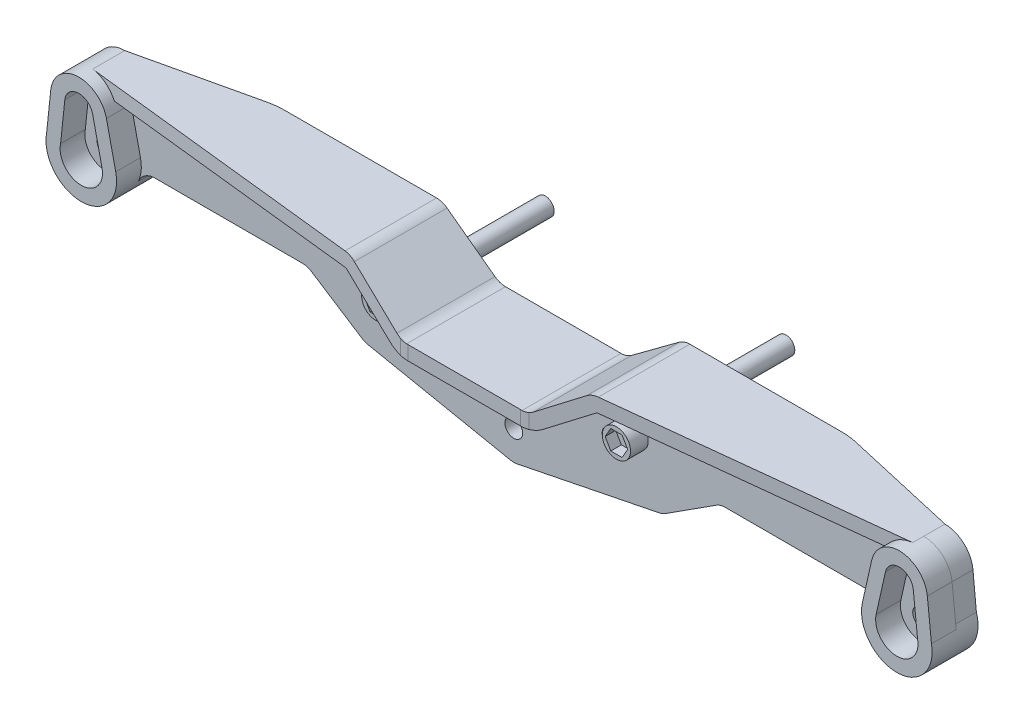
from build123d import *
from build123d.topology import SkipClean

# Parameters (mm, degrees)
SKETCH3_R                = 1.25
BOSS_EXTRUDE2_DEPTH      = 3
BOSS_EXTRUDE3_DEPTH      = 7
BOSS_EXTRUDE3_DEPTH_BACK = 7
CUT_EXTRUDE1_DEPTH       = 67.575853844
BOSS_EXTRUDE4_DEPTH      = 3.5
BOSS_EXTRUDE5_DEPTH      = 4
SKETCH9_R                = 2
BOSS_EXTRUDE6_DEPTH      = 2.5
BOSS_EXTRUDE7_START      = -24
SKETCH10_R               = 1.25
BOSS_EXTRUDE7_DEPTH      = 24
CUT_EXTRUDE2_DEPTH       = 1.5
BOSS_EXTRUDE8_START      = 2.5
SKETCH12_R               = 1.25
BOSS_EXTRUDE8_DEPTH      = 2.5


with BuildPart() as part:
    # Sketch3 → Boss-Extrude2 (new body)
    with BuildSketch(Plane.XY):
        with BuildLine():
            Line((-58.067604658, 9.129873432), (-17.927673113, 9.129873432))
            ThreePointArc((-17.927673113, 9.129873432), (-17.144364104, 9.003989478), (-16.439939924, 8.63901503))
            Line((-16.439939924, 8.63901503), (-9.662890391, 3.620731835))
            ThreePointArc((-9.662890391, 3.620731835), (-8.958466211, 3.255757387), (-8.175157202, 3.129873432))
            Line((-8.175157202, 3.129873432), (8.175157202, 3.129873432))
            ThreePointArc((8.175157202, 3.129873432), (8.958466211, 3.255757387), (9.662890391, 3.620731835))
            Line((9.662890391, 3.620731835), (16.439939924, 8.63901503))
            ThreePointArc((16.439939924, 8.63901503), (17.144364104, 9.003989478), (17.927673113, 9.129873432))
            Line((17.927673113, 9.129873432), (58.024732939, 9.129873432))
            ThreePointArc((58.024732939, 9.129873432), (60.713666824, 8.091230311), (62.006179367, 5.514690714))
            Line((62.006179367, 5.514690714), (62.485680247, 0.553616565))
            ThreePointArc((62.485680247, 0.553616565), (59.4550541, -5.663918261), (53.112535099, -2.904409812))
            ThreePointArc((53.112535099, -2.904409812), (52.191454269, -1.788745789), (50.80658819, -1.370126568))
            Line((50.80658819, -1.370126568), (29.971601132, -1.370126568))
            ThreePointArc((29.971601132, -1.370126568), (29.266449795, -1.471635044), (28.618561527, -1.767917294))
            Line((28.618561527, -1.767917294), (21.476313645, -6.364864122))
            ThreePointArc((21.476313645, -6.364864122), (21.063134423, -6.579260655), (20.617370927, -6.713342154))
            Line((20.617370927, -6.713342154), (0.494096887, -10.770508908))
            ThreePointArc((0.494096887, -10.770508908), (0, -10.819821603), (-0.494096887, -10.770508908))
            Line((-0.494096887, -10.770508908), (-20.617370927, -6.713342154))
            ThreePointArc((-20.617370927, -6.713342154), (-21.063134423, -6.579260655), (-21.476313645, -6.364864122))
            Line((-21.476313645, -6.364864122), (-28.618561527, -1.767917294))
            ThreePointArc((-28.618561527, -1.767917294), (-29.266449795, -1.471635044), (-29.971601132, -1.370126568))
            Line((-29.971601132, -1.370126568), (-50.80658819, -1.370126568))
            ThreePointArc((-50.80658819, -1.370126568), (-52.191454269, -1.788745789), (-53.112535099, -2.904409812))
            ThreePointArc((-53.112535099, -2.904409812), (-58.972993776, -5.814575808), (-62.69520812, -0.433204011))
            Line((-62.69520812, -0.433204011), (-62.044228019, 5.561691263))
            ThreePointArc((-62.044228019, 5.561691263), (-60.739002108, 8.107059295), (-58.067604658, 9.129873432))
        make_face()
        with Locations((0, -6.620126568)):
            Circle(SKETCH3_R, mode=Mode.SUBTRACT)
        with Locations((-57.724428918, -0.9729763)):
            Circle(SKETCH3_R, mode=Mode.SUBTRACT)
        with Locations(Location((57.724428918, -0.9729763, 0), (0, 0, 180))):
            Circle(SKETCH3_R, mode=Mode.SUBTRACT)
        with Locations((-20.303113823, 3.613972241)):
            Circle(SKETCH3_R, mode=Mode.SUBTRACT)
        with Locations((-17.030694447, 1.32049797)):
            Circle(SKETCH3_R, mode=Mode.SUBTRACT)
        with Locations((-13.758275071, -0.9729763)):
            Circle(SKETCH3_R, mode=Mode.SUBTRACT)
        with Locations(Location((13.758275071, -0.9729763, 0), (0, 0, 180))):
            Circle(SKETCH3_R, mode=Mode.SUBTRACT)
        with Locations(Location((17.030694447, 1.32049797, 0), (0, 0, 180))):
            Circle(SKETCH3_R, mode=Mode.SUBTRACT)
        with Locations(Location((20.303113823, 3.613972241, 0), (0, 0, 180))):
            Circle(SKETCH3_R, mode=Mode.SUBTRACT)
    extrude(amount=BOSS_EXTRUDE2_DEPTH)

    # Sketch5 → Boss-Extrude3 (add, two sides: drawn at the far end of the back side and taken through both)
    with BuildSketch(Plane.XY.offset(3).offset(-BOSS_EXTRUDE3_DEPTH_BACK)):
        with BuildLine():
            ThreePointArc((-17.630126475, 7.031701752), (-17.771011311, 7.104696641), (-17.927673113, 7.129873432))
            Line((-17.927673113, 7.129873432), (-58.067604658, 7.129873432))
            Line((-58.067604658, 7.129873432), (-58.067604658, 9.129873432))
            Line((-58.067604658, 9.129873432), (-17.927673113, 9.129873432))
            ThreePointArc((-17.927673113, 9.129873432), (-17.144364104, 9.003989478), (-16.439939924, 8.63901503))
            Line((-16.439939924, 8.63901503), (-9.662890391, 3.620731835))
            ThreePointArc((-9.662890391, 3.620731835), (-8.958466211, 3.255757387), (-8.175157202, 3.129873432))
            Line((-8.175157202, 3.129873432), (8.175157202, 3.129873432))
            ThreePointArc((8.175157202, 3.129873432), (8.958466211, 3.255757387), (9.662890391, 3.620731835))
            Line((9.662890391, 3.620731835), (16.439939924, 8.63901503))
            ThreePointArc((16.439939924, 8.63901503), (17.144364104, 9.003989478), (17.927673113, 9.129873432))
            Line((17.927673113, 9.129873432), (58.024732939, 9.129873432))
            Line((58.024732939, 9.129873432), (58.024732939, 7.129873432))
            Line((58.024732939, 7.129873432), (17.927673113, 7.129873432))
            ThreePointArc((17.927673113, 7.129873432), (17.771011311, 7.104696641), (17.630126475, 7.031701752))
            Line((17.630126475, 7.031701752), (10.853076942, 2.013418557))
            ThreePointArc((10.853076942, 2.013418557), (9.585113418, 1.356464551), (8.175157202, 1.129873432))
            Line((8.175157202, 1.129873432), (-8.175157202, 1.129873432))
            ThreePointArc((-8.175157202, 1.129873432), (-9.585113418, 1.356464551), (-10.853076942, 2.013418557))
            Line((-10.853076942, 2.013418557), (-17.630126475, 7.031701752))
        make_face()
    extrude(amount=BOSS_EXTRUDE3_DEPTH + BOSS_EXTRUDE3_DEPTH_BACK)

    # Sketch6 → Cut-Extrude1 (cut, through all)
    with BuildSketch(Plane(origin=(0, 9.129873432, 0), x_dir=(1, 0, 0), z_dir=(0, 1, 0))):
        with BuildLine():
            Line((-58.067604658, 0), (-41.667544995, 3.748585066))
            ThreePointArc((-41.667544995, 3.748585066), (-40.560490394, 3.936947485), (-39.43929698, 4))
            Line((-39.43929698, 4), (-58.067604658, 4))
            Line((-58.067604658, 4), (-58.067604658, 0))
        make_face()
        with BuildLine():
            Line((-58.067604658, -4.546629265), (-9.076321467, -9.93994917))
            ThreePointArc((-9.076321467, -9.93994917), (-8.530013446, -9.984976007), (-7.982058932, -10))
            Line((-7.982058932, -10), (-58.067604658, -10))
            Line((-58.067604658, -10), (-58.067604658, -4.546629265))
        make_face()
        with BuildLine():
            Line((58.067604658, -10), (58.067604658, -4.546629265))
            Line((58.067604658, -4.546629265), (9.076321467, -9.93994917))
            ThreePointArc((9.076321467, -9.93994917), (8.530013446, -9.984976007), (7.982058932, -10))
            Line((7.982058932, -10), (58.067604658, -10))
        make_face()
        with BuildLine():
            Line((58.067604658, 4), (58.067604658, 0))
            Line((58.067604658, 0), (41.667544995, 3.748585066))
            ThreePointArc((41.667544995, 3.748585066), (40.560490394, 3.936947485), (39.43929698, 4))
            Line((39.43929698, 4), (58.067604658, 4))
        make_face()
    extrude(amount=-CUT_EXTRUDE1_DEPTH, mode=Mode.SUBTRACT)

    # Sketch7 → Boss-Extrude4 (add)
    with BuildSketch(Plane.XY.offset(3)):
        with BuildLine():
            Line((-62.62884704, 0), (-62.044228019, 5.561691263))
            ThreePointArc((-62.044228019, 5.561691263), (-58.292178075, 9.123564304), (-54.164461461, 6.004786676))
            Line((-54.164461461, 6.004786676), (-52.845499921, 0.120665255))
            ThreePointArc((-52.845499921, 0.120665255), (-57.66276491, -5.972596041), (-62.62884704, 0))
        make_face()
        with BuildLine():
            Line((-56.116033059, 5.567330054), (-54.79707152, -0.316791367))
            ThreePointArc((-54.79707152, -0.316791367), (-57.727240857, -3.972974982), (-60.65055107, -0.311304821))
            Line((-60.65055107, -0.311304821), (-60.055607169, 5.348610756))
            ThreePointArc((-60.055607169, 5.348610756), (-58.178470954, 7.126798234), (-56.116033059, 5.567330054))
        make_face(mode=Mode.SUBTRACT)
    boss_extrude4 = extrude(amount=BOSS_EXTRUDE4_DEPTH)

    # Mirror1: Boss-Extrude4 across plane
    with SkipClean():  # the faces are left unmerged after this step: merging them gives an invalid solid
        add(boss_extrude4.mirror(Plane(origin=(0, 0, 0), x_dir=(0, 0, 1), z_dir=(1, 0, 0))))

    # Sketch8 → Boss-Extrude5 (add)
    with SkipClean():  # the faces are left unmerged after this step: merging them gives an invalid solid
        with BuildSketch(Plane(origin=(0, 0, -4), x_dir=(-1, 0, 0), z_dir=(0, 0, -1))):
            with BuildLine():
                Line((-23.819015015, 3.613972241), (-24.838972745, 3.613972241))
                Line((-24.838972745, 3.613972241), (-24.838972745, 7.129873432))
                Line((-24.838972745, 7.129873432), (-20.303113823, 7.129873432))
                ThreePointArc((-20.303113823, 7.129873432), (-22.789231398, 6.100089815), (-23.819015015, 3.613972241))
            make_face()
            with BuildLine():
                Line((24.838972745, 7.129873432), (20.303113823, 7.129873432))
                ThreePointArc((20.303113823, 7.129873432), (22.789231398, 6.100089815), (23.819015015, 3.613972241))
                Line((23.819015015, 3.613972241), (24.838972745, 3.613972241))
                Line((24.838972745, 3.613972241), (24.838972745, 7.129873432))
            make_face()
        extrude(amount=-BOSS_EXTRUDE5_DEPTH)

    # Sketch9 → Boss-Extrude6 (add)
    with SkipClean():  # the faces are left unmerged after this step: merging them gives an invalid solid
        with BuildSketch(Plane.XY.offset(3)):
            with Locations((17.030694447, 1.32049797)):
                Circle(SKETCH9_R)
        boss_extrude6 = extrude(amount=BOSS_EXTRUDE6_DEPTH)

    # Sketch10 → Boss-Extrude7 (add)
    with SkipClean():  # the faces are left unmerged after this step: merging them gives an invalid solid
        with BuildSketch(Plane.XY.offset(5.5).offset(BOSS_EXTRUDE7_START)):
            with Locations((17.030694447, 1.32049797)):
                Circle(SKETCH10_R)
        boss_extrude7 = extrude(amount=BOSS_EXTRUDE7_DEPTH)

    # Sketch11 → Cut-Extrude2 (cut)
    with SkipClean():  # the faces are left unmerged after this step: merging them gives an invalid solid
        with BuildSketch(Plane.XY.offset(5.5)):
            Polygon((17.827404099, 2.700439566), (16.233984796, 2.700439566), (15.437275144, 1.32049797), (16.233984796, -0.059443625), (17.827404099, -0.059443625), (18.62411375, 1.32049797), align=None)
        cut_extrude2 = extrude(amount=-CUT_EXTRUDE2_DEPTH, mode=Mode.SUBTRACT)

    # Sketch12 → Boss-Extrude8 (add)
    with SkipClean():  # the faces are left unmerged after this step: merging them gives an invalid solid
        with BuildSketch(Plane(origin=(0, 0, 0), x_dir=(-1, 0, 0), z_dir=(0, 0, -1)).offset(BOSS_EXTRUDE8_START)):
            Polygon((-15.29864364, 4.32049797), (-18.762745255, 4.32049797), (-20.494796062, 1.32049797), (-18.762745255, -1.67950203), (-15.29864364, -1.67950203), (-13.566592832, 1.32049797), align=None)
            with Locations(Location((-17.030694447, 1.32049797, 0), (0, 0, 180))):
                Circle(SKETCH12_R, mode=Mode.SUBTRACT)
        boss_extrude8 = extrude(amount=-BOSS_EXTRUDE8_DEPTH)

    # Mirror2: Boss-Extrude6, Boss-Extrude7, Cut-Extrude2, Boss-Extrude8 across plane
    with SkipClean():  # the faces are left unmerged after this step: merging them gives an invalid solid
        add(boss_extrude6.mirror(Plane(origin=(0, 0, 0), x_dir=(0, 0, 1), z_dir=(1, 0, 0))))
        add(boss_extrude7.mirror(Plane(origin=(0, 0, 0), x_dir=(0, 0, 1), z_dir=(1, 0, 0))))
        add(cut_extrude2.mirror(Plane(origin=(0, 0, 0), x_dir=(0, 0, 1), z_dir=(1, 0, 0))), mode=Mode.SUBTRACT)
        add(boss_extrude8.mirror(Plane(origin=(0, 0, 0), x_dir=(0, 0, 1), z_dir=(1, 0, 0))))


solid = part.part
